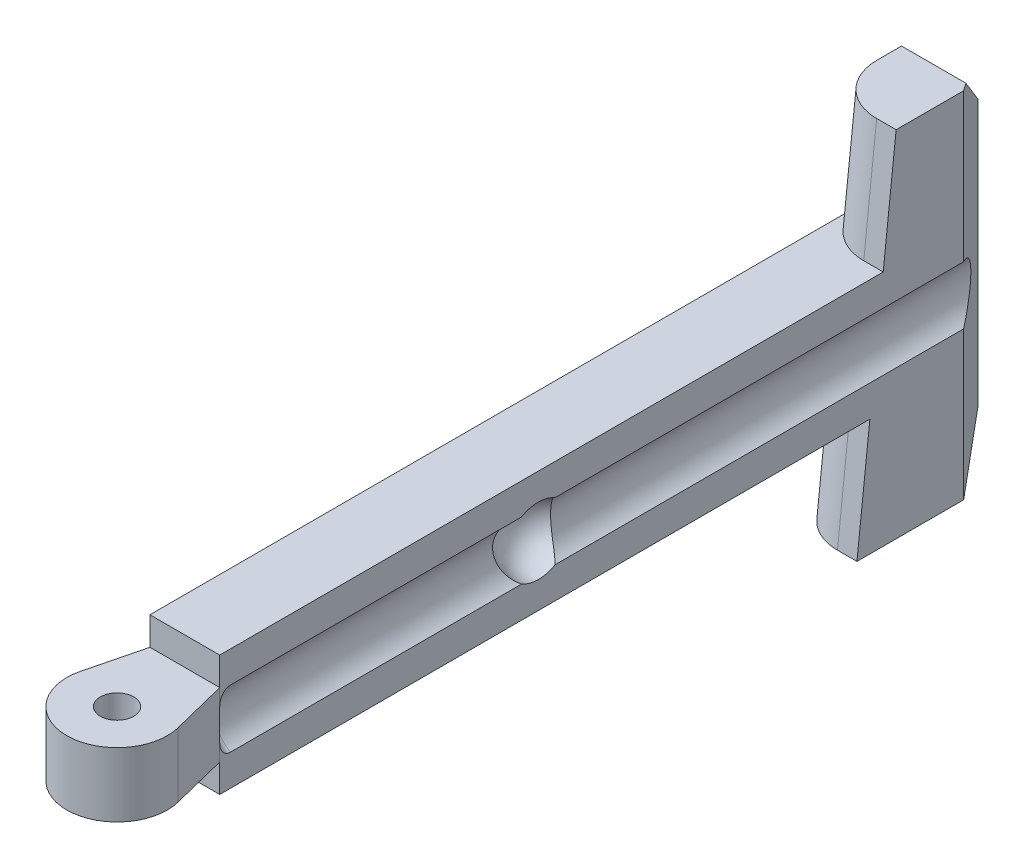
from build123d import *
from OCP.BRepFilletAPI import BRepFilletAPI_MakeChamfer
from build123d.topology import SkipClean

# Parameters (mm, degrees)
SKETCH1_W                    = 6.604
SKETCH1_H                    = 11.43
BOSS_EXTRUDE1_DEPTH          = 74.93
SKETCH2_W                    = 14.6304
SKETCH2_H                    = 11.049
BOSS_EXTRUDE2_DEPTH          = 6.604
CUT_EXTRUDE1_DEPTH           = 79.507471982
SKETCH4_R                    = 3.175
CUT_EXTRUDE2_DEPTH           = 79.507471982
FILLET1_R                    = 4.7625
CHAMFER1_SIZE                = 3.175
CHAMFER1_SIZE2               = 1.833087105
CHAMFER2_SIZE                = 3.175
CHAMFER2_SIZE2               = 4.534369921
CHAMFER3_SIZE                = 3.81
CHAMFER3_SIZE2               = 4.540581188
BOSS_EXTRUDE3_DEPTH          = 3.048
F_1_8_0_125_DIAMETER_HOLE1_D = 3.175
FILLET2_R                    = 1.016


with BuildPart() as part:
    # Sketch1 → Boss-Extrude1 (new body)
    with BuildSketch(Plane.XY):
        with Locations((3.302, 5.715)):
            Rectangle(SKETCH1_W, SKETCH1_H)
    extrude(amount=BOSS_EXTRUDE1_DEPTH)

    # Sketch2 → Boss-Extrude2 (add)
    with BuildSketch(Plane(origin=(6.604, 0, 0), x_dir=(0, 0, -1), z_dir=(1, 0, 0))):
        with Locations((-7.3152, -5.5245)):
            Rectangle(SKETCH2_W, SKETCH2_H)
        with Locations((-7.3152, 16.9545)):
            Rectangle(SKETCH2_W, SKETCH2_H)
    extrude(amount=-BOSS_EXTRUDE2_DEPTH)

    # Sketch3 → Cut-Extrude1 (cut, through all)
    with BuildSketch(Plane(origin=(6.604, 0, 0), x_dir=(0, 0, -1), z_dir=(1, 0, 0))):
        Polygon((-10.922, 22.479), (-14.6304, 22.479), (-14.6304, 11.43), (-12.144086364, 11.43), align=None)
        Polygon((-14.6304, 0), (-14.6304, -11.049), (-13.408313636, 0), align=None)
    extrude(amount=-CUT_EXTRUDE1_DEPTH, mode=Mode.SUBTRACT)

    # Sketch4 → Cut-Extrude2 (cut, through all)
    with BuildSketch(Plane.XY.offset(74.93)):
        with Locations((8.1915, 5.715)):
            Circle(SKETCH4_R)
    extrude(amount=-CUT_EXTRUDE2_DEPTH, mode=Mode.SUBTRACT)

    # Fillet1
    fillet1_edges = [part.edges().sort_by_distance(p)[0] for p in [
        (0, -5.5245, 14.019356818),
        (0, 16.9545, 11.533043182),
    ]]
    fillet(fillet1_edges, radius=FILLET1_R)

    # Chamfer1
    chamfer1_edges = [part.edges().sort_by_distance(p)[0] for p in [
        (0, 5.715, 0),
    ]]
    chamfer1_side = [part.faces().sort_by_distance(p)[0] for p in [
        (0, 5.39199625, 31.764871667),
    ]]
    chamfer(chamfer1_edges, length=CHAMFER1_SIZE, length2=CHAMFER1_SIZE2, reference=chamfer1_side[0])

    # Chamfer2
    chamfer2_edges = [part.edges().sort_by_distance(p)[0] for p in [
        (6.604, 15.471815329, 0),
    ]]
    chamfer2_side = [part.faces().sort_by_distance(p)[0] for p in [
        (4.148704261, 5.715, 0),
    ]]
    chamfer(chamfer2_edges, length=CHAMFER2_SIZE, length2=CHAMFER2_SIZE2, reference=chamfer2_side[0])

    # Chamfer3: one chamfer whose edges measure the first distance from different faces: ONE call of the kernel's chamfer builder (chamfer() names one face for all edges)
    chamfer3_edges_1 = [part.edges().sort_by_distance(p)[0] for p in [
        (2.631043552, 22.479, 0),
    ]]
    chamfer3_side_1 = [part.faces().sort_by_distance(p)[0] for p in [
        (3.348233995, 22.479, 5.806565438),
    ]]
    chamfer3_edges_2 = [part.edges().sort_by_distance(p)[0] for p in [
        (2.631043552, -11.049, 0),
    ]]
    chamfer3_side_2 = [part.faces().sort_by_distance(p)[0] for p in [
        (2.631043552, 5.715, 0),
    ]]
    chamfer3 = BRepFilletAPI_MakeChamfer(part.part.solid().wrapped)
    for e in chamfer3_edges_1:
        chamfer3.Add(CHAMFER3_SIZE, CHAMFER3_SIZE2, e.wrapped, chamfer3_side_1[0].wrapped)  # the first distance lies on this face
    for e in chamfer3_edges_2:
        chamfer3.Add(CHAMFER3_SIZE, CHAMFER3_SIZE2, e.wrapped, chamfer3_side_2[0].wrapped)  # the first distance lies on this face
    add(Compound.cast(chamfer3.Shape()), mode=Mode.REPLACE)

    # Sketch5 → Boss-Extrude3 (add, symmetric)
    with BuildSketch(Plane(origin=(0, 5.715, 0), x_dir=(-1, 0, 0), z_dir=(0, -1, 0))):
        with BuildLine():
            Line((0, -74.93), (-6.604, -74.93))
            Line((-6.604, -74.93), (-7.921538097, -80.185366149))
            ThreePointArc((-7.921538097, -80.185366149), (-3.302, -86.106), (1.317538097, -80.185366149))
            Line((1.317538097, -80.185366149), (0, -74.93))
        make_face()
    extrude(amount=BOSS_EXTRUDE3_DEPTH, both=True)

    # 1/8 (0.125) Diameter Hole1 (through all)
    with Locations(Plane(origin=(0, 2.667, 0), x_dir=(-1, 0, 0), z_dir=(0, -1, 0))):
        with Locations((-3.302, -81.3435)):
            Hole(F_1_8_0_125_DIAMETER_HOLE1_D / 2)

    # Fillet2
    fillet2_edges = [part.edges().sort_by_distance(p)[0] for p in [
        (5.0165, 5.715, 74.93),
    ]]
    fillet(fillet2_edges, radius=FILLET2_R)

    # Sketch8 → Cut-Revolve3 (revolve, cut)
    with SkipClean():  # the faces are left unmerged after this step: merging them gives an invalid solid
        with BuildSketch(Plane(origin=(0, 5.715, 0), x_dir=(-1, 0, 0), z_dir=(0, -1, 0))):
            with BuildLine():
                ThreePointArc((-3.429, -44.7802), (-4.35893597, -42.53513597), (-6.604, -41.6052))
                Line((-6.604, -41.6052), (-6.604, -47.9552))
                ThreePointArc((-6.604, -47.9552), (-4.35893597, -47.02526403), (-3.429, -44.7802))
            make_face()
            with BuildLine():
                Line((-6.604, -47.9552), (-6.604, -41.6052))
                ThreePointArc((-6.604, -41.6052), (-9.779, -44.7802), (-6.604, -47.9552))
            make_face()
        revolve(axis=Axis((6.604, 5.715, 14.6304), (0, 0, 1)), mode=Mode.SUBTRACT)


solid = part.part
